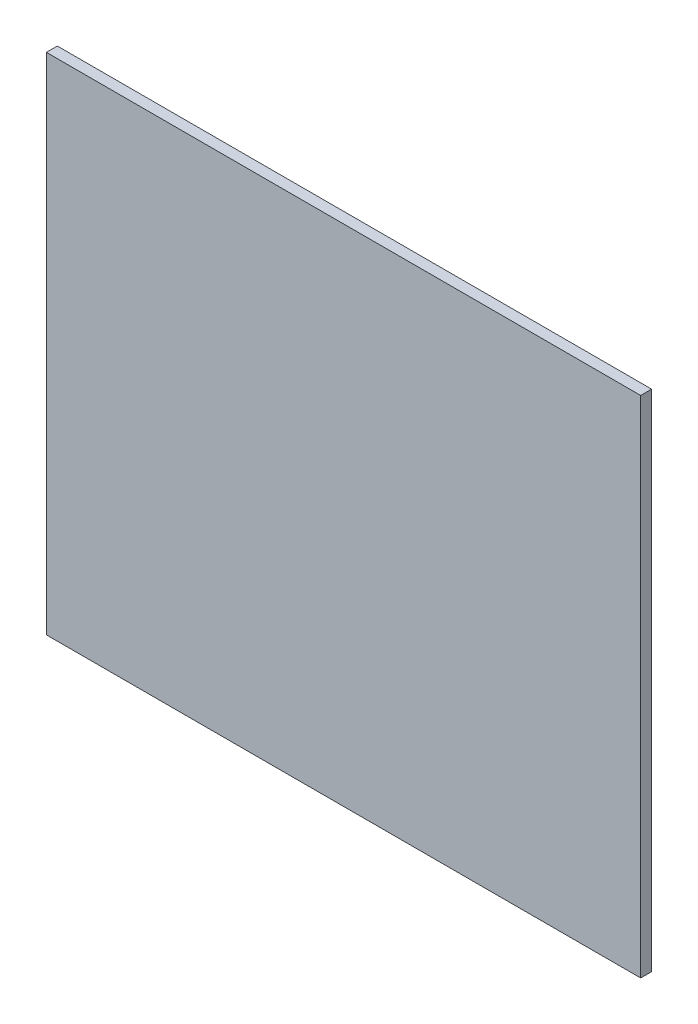
from build123d import *

# Parameters (mm, degrees)
SKETCH1_W           = 55.165625
SKETCH1_H           = 46.827898978
BOSS_EXTRUDE1_DEPTH = 1.016


with BuildPart() as part:
    # Sketch1 → Boss-Extrude1 (new body)
    with BuildSketch(Plane.XY):
        with Locations((27.5828125, 23.413949489)):
            Rectangle(SKETCH1_W, SKETCH1_H)
    extrude(amount=BOSS_EXTRUDE1_DEPTH)


solid = part.part
